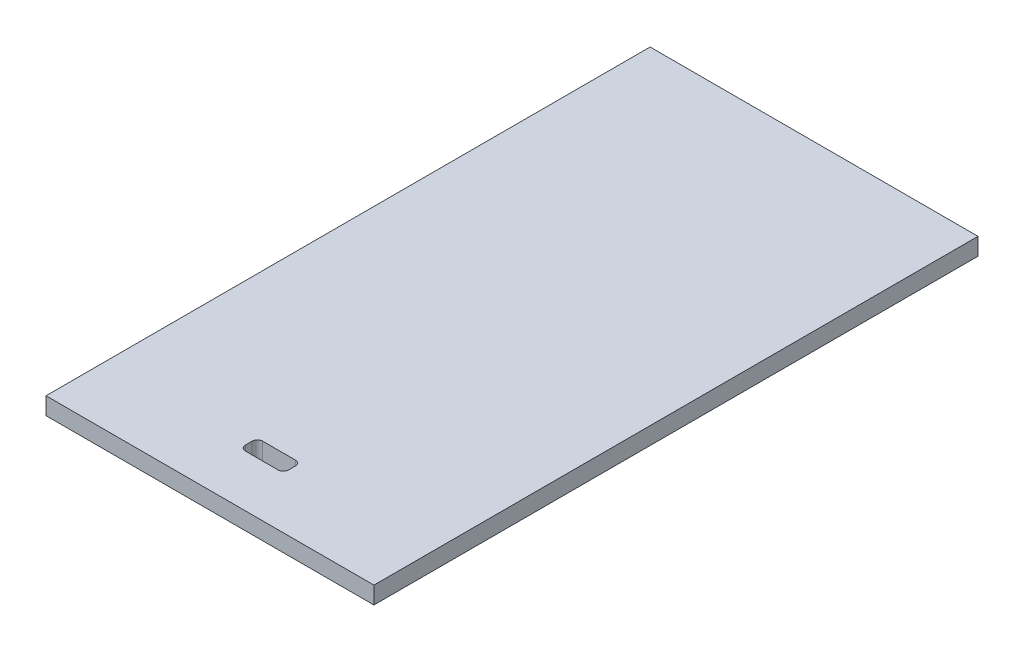
from build123d import *

# Parameters (mm, degrees)
EXTRUDE_1_DEPTH     = 20
SKETCH_2_W          = 336
SKETCH_2_H          = 230
CUT_EXTRUDE_1_DEPTH = 20
CUT_EXTRUDE_2_DEPTH = 20


with BuildPart() as part:
    # 草图1 → 凸台-拉伸1 (new body)
    with BuildSketch(Plane(origin=(0, 0, 0), x_dir=(1, 0, 0), z_dir=(0, 1, 0))):
        Polygon((0, 0), (380, 0), (716, 0), (716, 230), (380, 230), (380, 700), (0, 700), align=None)
    extrude(amount=EXTRUDE_1_DEPTH)

    # 草图2 → 切除-拉伸1 (cut)
    with BuildSketch(Plane(origin=(0, 20, 0), x_dir=(1, 0, 0), z_dir=(0, 1, 0))):
        with Locations((548, 115)):
            Rectangle(SKETCH_2_W, SKETCH_2_H)
    extrude(amount=-CUT_EXTRUDE_1_DEPTH, mode=Mode.SUBTRACT)

    # 草图3 → 切除-拉伸2 (cut)
    with BuildSketch(Plane(origin=(0, 20, 0), x_dir=(1, 0, 0), z_dir=(0, 1, 0))):
        with BuildLine():
            Line((171, 80), (209, 80))
            ThreePointArc((209, 80), (213.242640687, 78.242640687), (215, 74))
            Line((215, 74), (215, 66))
            ThreePointArc((215, 66), (213.242640687, 61.757359313), (209, 60))
            Line((209, 60), (171, 60))
            ThreePointArc((171, 60), (166.757359313, 61.757359313), (165, 66))
            Line((165, 66), (165, 74))
            ThreePointArc((165, 74), (166.757359313, 78.242640687), (171, 80))
        make_face()
    extrude(amount=-CUT_EXTRUDE_2_DEPTH, mode=Mode.SUBTRACT)


solid = part.part
